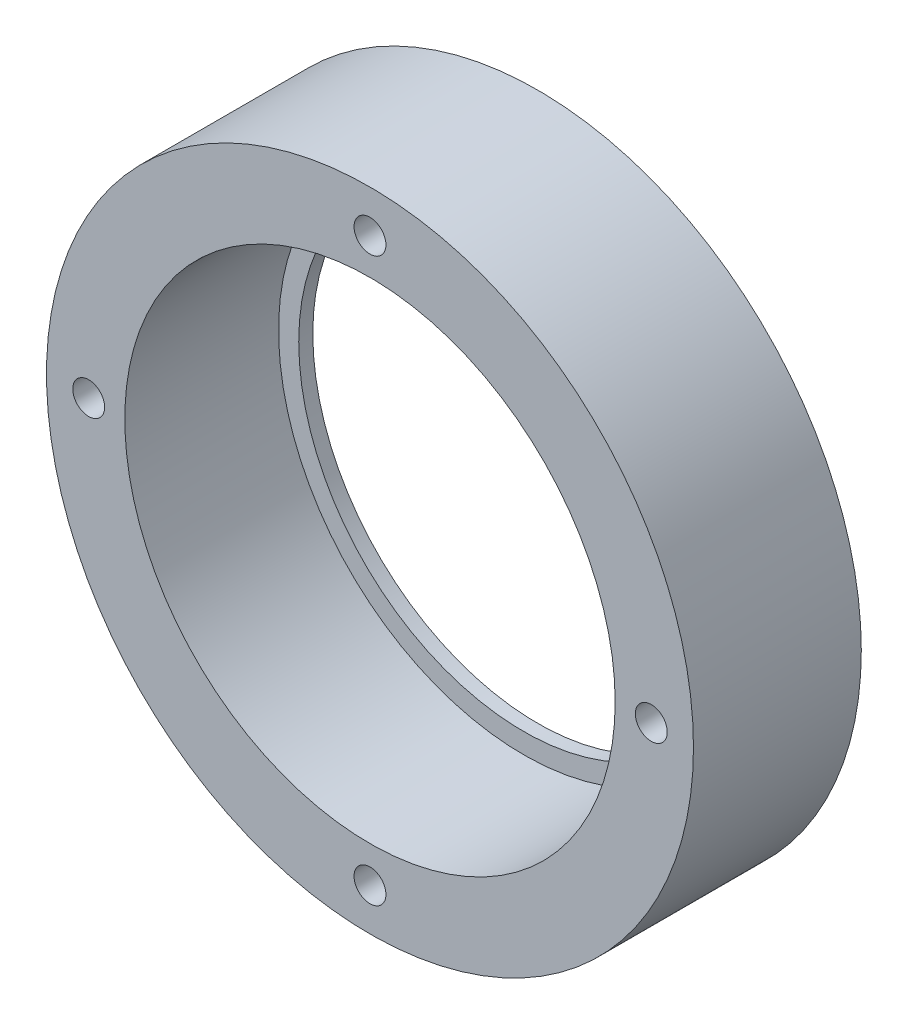
from build123d import *

# Parameters (mm, degrees)
SKETCH1_R           = 34.5
SKETCH1_R_2         = 24
BOSS_EXTRUDE1_DEPTH = 1.5
SKETCH3_R           = 34.5
SKETCH3_R_2         = 26.15
BOSS_EXTRUDE2_DEPTH = 16.4
SKETCH4_R           = 1.7
CUT_EXTRUDE1_DEPTH  = 52.970279968
CHAMFER1_SIZE       = 0.4


with BuildPart() as part:
    # Sketch1 → Boss-Extrude1 (new body)
    with BuildSketch(Plane.XY):
        Circle(SKETCH1_R)
        Circle(SKETCH1_R_2, mode=Mode.SUBTRACT)
    extrude(amount=BOSS_EXTRUDE1_DEPTH)

    # Sketch3 → Boss-Extrude2 (add)
    with BuildSketch(Plane.XY.offset(1.5)):
        Circle(SKETCH3_R)
        Circle(SKETCH3_R_2, mode=Mode.SUBTRACT)
    extrude(amount=BOSS_EXTRUDE2_DEPTH)

    # Sketch4 → Cut-Extrude1 (cut, through all)
    with BuildSketch(Plane.XY.offset(17.9)):
        with Locations((0, 30)):
            Circle(SKETCH4_R)
        with Locations((30, 0)):
            Circle(SKETCH4_R)
        with Locations((0, -30)):
            Circle(SKETCH4_R)
        with Locations((-30, 0)):
            Circle(SKETCH4_R)
    extrude(amount=-CUT_EXTRUDE1_DEPTH, mode=Mode.SUBTRACT)

    # Chamfer1
    chamfer1_edges = [part.edges().sort_by_distance(p)[0] for p in [
        (-1.7, 30, 0),
        (28.3, 0, 0),
        (-1.7, -30, 0),
        (-31.7, 0, 0),
    ]]
    chamfer(chamfer1_edges, length=CHAMFER1_SIZE)


solid = part.part
